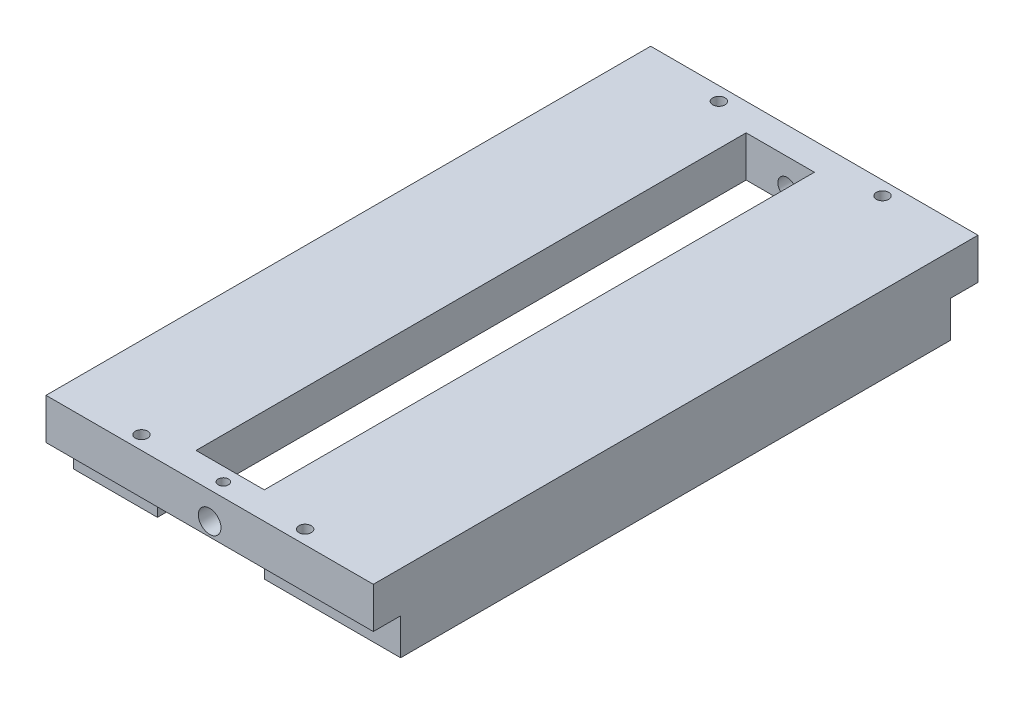
from build123d import *
from build123d.topology import SkipClean

# Parameters (mm, degrees)
SKETCH1_W                        = 91
SKETCH1_H                        = 133
BOSS_EXTRUDE1_DEPTH              = 9
SKETCH8_W                        = 85.75
SKETCH8_H                        = 121
BOSS_EXTRUDE2_DEPTH              = 8
F_1_8_0_125_DIAMETER_HOLE1_D     = 3.175
F_1_8_0_125_DIAMETER_HOLE1_DEPTH = 15.439
F_1_8_0_125_DIAMETER_HOLE1_TIP   = 0.953866233
CUT_EXTRUDE1_DEPTH               = 83.349863388
CUT_EXTRUDE1_DEPTH_BACK          = 83.349863388
SKETCH9_W                        = 35
SKETCH9_H                        = 8
CUT_EXTRUDE2_DEPTH               = 83.349863388
TAP_DRILL_FOR_10_32_TAP1_D       = 4.0386
TAP_DRILL_FOR_10_32_TAP1_DEPTH   = 6
F_10_CLEARANCE_HOLE1_D           = 4.9784
F_10_CLEARANCE_HOLE1_DEPTH       = 6
TAP_DRILL_FOR_4_40_TAP1_REACH    = 84.35
TAP_DRILL_FOR_4_40_TAP1_BORE_R   = 1.1303
TAP_DRILL_FOR_6_32_TAP1_D        = 2.7051
CUT_EXTRUDE4_REACH               = 143.592
SKETCH20_W                       = 9.5
SKETCH20_H                       = 9
CUT_EXTRUDE5_DEPTH               = 81.929077829
CUT_EXTRUDE5_DEPTH_BACK          = 81.929077829
SKETCH21_OUTSIDE_W               = 119.582
SKETCH21_OUTSIDE_H               = 166.832
SKETCH21_OUTSIDE_W_2             = 72
SKETCH21_OUTSIDE_H_2             = 133
SKETCH22_W                       = 11.4873
SKETCH22_H                       = 121
SKETCH22_R                       = 1.5875
BOSS_EXTRUDE3_DEPTH              = 8


with BuildPart() as part:
    # Sketch1 → Boss-Extrude1 (new body)
    with BuildSketch(Plane(origin=(0, 0, 0), x_dir=(1, 0, 0), z_dir=(0, 1, 0))):
        Rectangle(SKETCH1_W, SKETCH1_H)
    extrude(amount=-BOSS_EXTRUDE1_DEPTH)

    # Sketch8 → Boss-Extrude2 (add)
    with BuildSketch(Plane.XZ.offset(9)):
        Rectangle(SKETCH8_W, SKETCH8_H)
    extrude(amount=BOSS_EXTRUDE2_DEPTH)

    # 1/8 (0.125) Diameter Hole1
    with Locations(Plane(origin=(0, -17, 0), x_dir=(-1, 0, 0), z_dir=(0, -1, 0))):
        with Locations((-12.7, -38.1), (-12.7, 38.1)):
            Hole(F_1_8_0_125_DIAMETER_HOLE1_D / 2, depth=F_1_8_0_125_DIAMETER_HOLE1_DEPTH)
            with Locations((0, 0, -(F_1_8_0_125_DIAMETER_HOLE1_DEPTH + F_1_8_0_125_DIAMETER_HOLE1_TIP / 2))):  # 118° drill point
                Cone(0, F_1_8_0_125_DIAMETER_HOLE1_D / 2, F_1_8_0_125_DIAMETER_HOLE1_TIP, mode=Mode.SUBTRACT)

    # Sketch9 → Cut-Extrude1 (cut, two sides: drawn at the far end of the back side and taken through both)
    with BuildSketch(Plane.XY.offset(-CUT_EXTRUDE1_DEPTH_BACK)):
        with Locations((0, -13)):
            Rectangle(SKETCH9_W, SKETCH9_H)
    extrude(amount=CUT_EXTRUDE1_DEPTH + CUT_EXTRUDE1_DEPTH_BACK, mode=Mode.SUBTRACT)

    # Sketch10 → Cut-Extrude2 (cut, through all)
    with BuildSketch(Plane(origin=(0, 0, 0), x_dir=(1, 0, 0), z_dir=(0, 1, 0))):
        Polygon((-6, 60.5), (6, 60.5), (6.0127, 60.5), (6.0127, -60.5), (6, -60.5), (-6, -60.5), (-9, -60.5), (-9, 60.5), align=None)
    extrude(amount=-CUT_EXTRUDE2_DEPTH, mode=Mode.SUBTRACT)

    # Tap Drill for #10-32 Tap1
    with Locations(Plane.XY.offset(-60.5)):
        with Locations((0, -6)):
            Hole(TAP_DRILL_FOR_10_32_TAP1_D / 2, depth=TAP_DRILL_FOR_10_32_TAP1_DEPTH)

    # #10 Clearance Hole1
    with Locations(Plane.XY.offset(66.5)):
        with Locations((0, -6)):
            Hole(F_10_CLEARANCE_HOLE1_D / 2, depth=F_10_CLEARANCE_HOLE1_DEPTH)

    # Tap Drill for #4-40 Tap1 bore → Tap Drill for #4-40 Tap1 (cut, up to next)
    with BuildSketch(Plane(origin=(0, 0, 0), x_dir=(1, 0, 0), z_dir=(0, 1, 0)), mode=Mode.PRIVATE) as tap_drill_for_4_40_tap1_sk1:
        with Locations((0, -63.5)):
            Circle(TAP_DRILL_FOR_4_40_TAP1_BORE_R)
    tap_drill_for_4_40_tap1_tool1 = extrude(tap_drill_for_4_40_tap1_sk1.sketch, amount=-TAP_DRILL_FOR_4_40_TAP1_REACH, mode=Mode.PRIVATE) & part.part
    add(tap_drill_for_4_40_tap1_tool1.solids().sort_by_distance((0, 0, 63.5))[0], mode=Mode.SUBTRACT)

    # Tap Drill for #6-32 Tap1 (through all)
    with Locations(Plane(origin=(0, 0, 0), x_dir=(1, 0, 0), z_dir=(0, 1, 0))):
        with Locations((-18, -63.5), (18, -63.5), (18, 63.5), (-18, 63.5)):
            Hole(TAP_DRILL_FOR_6_32_TAP1_D / 2)

    # Sketch20 → Cut-Extrude4 (cut, up to next)
    with BuildSketch(Plane.XY.offset(66.5), mode=Mode.PRIVATE) as cut_extrude4_sk1:
        with Locations((40.75, -4.5)):
            Rectangle(SKETCH20_W, SKETCH20_H)
    cut_extrude4_tool1 = extrude(cut_extrude4_sk1.sketch, amount=-CUT_EXTRUDE4_REACH, mode=Mode.PRIVATE) & part.part
    # Sketch20 → Cut-Extrude4 (cut, up to next)
    with BuildSketch(Plane.XY.offset(66.5), mode=Mode.PRIVATE) as cut_extrude4_sk2:
        with Locations((-40.75, -4.5)):
            Rectangle(SKETCH20_W, SKETCH20_H)
    cut_extrude4_tool2 = extrude(cut_extrude4_sk2.sketch, amount=-CUT_EXTRUDE4_REACH, mode=Mode.PRIVATE) & part.part
    add(cut_extrude4_tool1.solids().sort_by_distance((40.75, -4.5, 66.5))[0], mode=Mode.SUBTRACT)
    add(cut_extrude4_tool2.solids().sort_by_distance((-40.75, -4.5, 66.5))[0], mode=Mode.SUBTRACT)

    # Sketch21 outside → Cut-Extrude5 (cut, two sides: drawn at the far end of the back side and taken through both)
    with BuildSketch(Plane(origin=(0, 0, 0), x_dir=(1, 0, 0), z_dir=(0, 1, 0)).offset(-CUT_EXTRUDE5_DEPTH_BACK)):
        Rectangle(SKETCH21_OUTSIDE_W, SKETCH21_OUTSIDE_H)
        Rectangle(SKETCH21_OUTSIDE_W_2, SKETCH21_OUTSIDE_H_2, mode=Mode.SUBTRACT)
    extrude(amount=CUT_EXTRUDE5_DEPTH + CUT_EXTRUDE5_DEPTH_BACK, mode=Mode.SUBTRACT)

    # Sketch22 → Boss-Extrude3 (add)
    with SkipClean():  # the faces are left unmerged after this step: merging them gives an invalid solid
        with BuildSketch(Plane.XZ.offset(9)):
            with Locations((11.75635, 0)):
                Rectangle(SKETCH22_W, SKETCH22_H)
            with Locations(Location((12.7, 38.1, 0), (0, 0, 270))):
                Circle(SKETCH22_R, mode=Mode.SUBTRACT)
            with Locations(Location((12.7, -38.1, 0), (0, 0, 270))):
                Circle(SKETCH22_R, mode=Mode.SUBTRACT)
        extrude(amount=BOSS_EXTRUDE3_DEPTH)


solid = part.part
